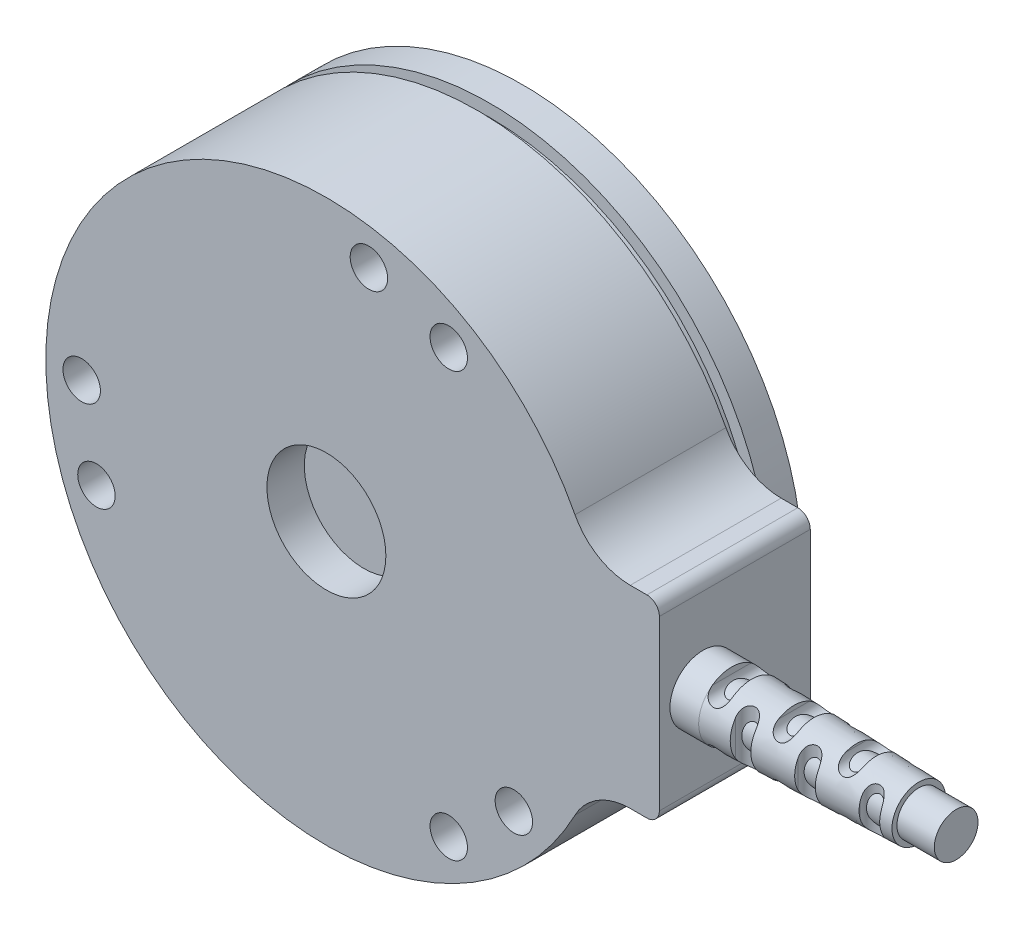
from build123d import *

# Parameters (mm, degrees)
SCHIZZO1_R                        = 1.5
ESTRUSIONE_ESTRUSIONE1_DEPTH      = 5
SCHIZZO2_R                        = 4.769
TAGLIO_ESTRUSIONE1_DEPTH          = 3
ESTRUSIONE_ESTRUSIONE2_START      = 7.1
ESTRUSIONE_ESTRUSIONE2_DEPTH      = 7.1
SCHIZZO4_R                        = 21.5
ESTRUSIONE_ESTRUSIONE3_DEPTH      = 1
ESTRUSIONE_ESTRUSIONE4_START      = 2.6
SCHIZZO5_R                        = 22.5
ESTRUSIONE_ESTRUSIONE4_DEPTH      = 2.6
SCHIZZO6_R                        = 2.65
ESTRUSIONE_ESTRUSIONE5_DEPTH      = 17.3
SMUSSO1_SIZE                      = 15
SMUSSO1_SIZE2                     = 0.5
TAGLIO_ESTRUSIONE2_DEPTH          = 52.853061626
TAGLIO_ESTRUSIONE3_DEPTH          = 55.456886698
ESTRUSIONE_ESTRUSIONE6_DEPTH      = 3
ESTRUSIONE_ESTRUSIONE6_DEPTH_BACK = 17.3
SCHIZZO9_R                        = 1.75
SCHIZZO10_R                       = 1.5
SCHIZZO10_R_2                     = 4.788
TAGLIO_ESTRUSIONE4_DEPTH          = 3


with BuildPart() as part:
    # Schizzo1 → Estrusione-Estrusione1 (new body)
    with BuildSketch(Plane.XY):
        with BuildLine():
            Line((26.7, 6.75), (26.7, -6.75))
            ThreePointArc((26.7, -6.75), (26.407106781, -7.457106781), (25.7, -7.75))
            Line((25.7, -7.75), (24.365703355, -7.75))
            ThreePointArc((24.365703355, -7.75), (21.776389652, -8.472681384), (19.935575473, -10.431818182))
            ThreePointArc((19.935575473, -10.431818182), (-22.5, 0), (19.935575473, 10.431818182))
            ThreePointArc((19.935575473, 10.431818182), (21.776389652, 8.472681384), (24.365703355, 7.75))
            Line((24.365703355, 7.75), (25.7, 7.75))
            ThreePointArc((25.7, 7.75), (26.407106781, 7.457106781), (26.7, 6.75))
        make_face()
        with Locations((9.811, 16.993150473)):
            Circle(SCHIZZO1_R, mode=Mode.SUBTRACT)
        with Locations(Location((3.407324542, 19.32389773, 0), (0, 0, 180))):
            Circle(SCHIZZO1_R, mode=Mode.SUBTRACT)
        with Locations(Location((15.031324063, -12.612778477, 0), (0, 0, 180))):
            Circle(SCHIZZO1_R, mode=Mode.SUBTRACT)
        with Locations((9.811, -16.993150473)):
            Circle(SCHIZZO1_R, mode=Mode.SUBTRACT)
        with Locations(Location((-18.438648605, -6.711119252, 0), (0, 0, 180))):
            Circle(SCHIZZO1_R, mode=Mode.SUBTRACT)
        with Locations((-19.622, 0)):
            Circle(SCHIZZO1_R, mode=Mode.SUBTRACT)
    extrude(amount=ESTRUSIONE_ESTRUSIONE1_DEPTH)

    # Schizzo2 → Taglio-Estrusione1 (cut)
    with BuildSketch(Plane.XY.offset(5)):
        Circle(SCHIZZO2_R)
    extrude(amount=-TAGLIO_ESTRUSIONE1_DEPTH, mode=Mode.SUBTRACT)

    # Schizzo3 → Estrusione-Estrusione2 (add)
    with BuildSketch(Plane(origin=(0, 0, 0), x_dir=(-1, 0, 0), z_dir=(0, 0, -1)).offset(ESTRUSIONE_ESTRUSIONE2_START)):
        with BuildLine():
            Line((-26.7, 6.75), (-26.7, -6.75))
            ThreePointArc((-26.7, -6.75), (-26.407106781, -7.457106781), (-25.7, -7.75))
            Line((-25.7, -7.75), (-24.365703355, -7.75))
            ThreePointArc((-24.365703355, -7.75), (-21.776389652, -8.472681384), (-19.935575473, -10.431818182))
            ThreePointArc((-19.935575473, -10.431818182), (22.5, 0), (-19.935575473, 10.431818182))
            ThreePointArc((-19.935575473, 10.431818182), (-21.776389652, 8.472681384), (-24.365703355, 7.75))
            Line((-24.365703355, 7.75), (-25.7, 7.75))
            ThreePointArc((-25.7, 7.75), (-26.407106781, 7.457106781), (-26.7, 6.75))
        make_face()
    extrude(amount=-ESTRUSIONE_ESTRUSIONE2_DEPTH)

    # Schizzo4 → Estrusione-Estrusione3 (add)
    with BuildSketch(Plane(origin=(0, 0, -7.1), x_dir=(-1, 0, 0), z_dir=(0, 0, -1))):
        Circle(SCHIZZO4_R)
    extrude(amount=ESTRUSIONE_ESTRUSIONE3_DEPTH)

    # Schizzo5 → Estrusione-Estrusione4 (add)
    with BuildSketch(Plane(origin=(0, 0, -8.1), x_dir=(-1, 0, 0), z_dir=(0, 0, -1)).offset(ESTRUSIONE_ESTRUSIONE4_START)):
        Circle(SCHIZZO5_R)
    extrude(amount=-ESTRUSIONE_ESTRUSIONE4_DEPTH)

    # Schizzo6 → Estrusione-Estrusione5 (add)
    with BuildSketch(Plane(origin=(26.7, 0, 0), x_dir=(0, 0, -1), z_dir=(1, 0, 0))):
        with Locations(Location((-1.5, 0, 0), (0, 0, 180))):
            Circle(SCHIZZO6_R)
    extrude(amount=ESTRUSIONE_ESTRUSIONE5_DEPTH)

    # Smusso1
    smusso1_edges = [part.edges().sort_by_distance(p)[0] for p in [
        (44, 0, -1.15),
    ]]
    smusso1_side = [part.faces().sort_by_distance(p)[0] for p in [
        (35.35, 0, -1.15),
    ]]
    chamfer(smusso1_edges, length=SMUSSO1_SIZE, length2=SMUSSO1_SIZE2, reference=smusso1_side[0])

    # Schizzo7 → Taglio-Estrusione2 (cut, through all)
    with BuildSketch(Plane.XY.offset(5)):
        with BuildLine():
            Line((29, 2.15), (29, 3.15))
            ThreePointArc((29, 3.15), (29.8, 3.95), (30.6, 3.15))
            Line((30.6, 3.15), (30.6, 2.15))
            ThreePointArc((30.6, 2.15), (29.8, 1.35), (29, 2.15))
        make_face()
        with BuildLine():
            Line((34, 2.15), (34, 3.15))
            ThreePointArc((34, 3.15), (34.8, 3.95), (35.6, 3.15))
            Line((35.6, 3.15), (35.6, 2.15))
            ThreePointArc((35.6, 2.15), (34.8, 1.35), (34, 2.15))
        make_face()
        with BuildLine():
            Line((39, 2.15), (39, 3.15))
            ThreePointArc((39, 3.15), (39.8, 3.95), (40.6, 3.15))
            Line((40.6, 3.15), (40.6, 2.15))
            ThreePointArc((40.6, 2.15), (39.8, 1.35), (39, 2.15))
        make_face()
        with BuildLine():
            Line((39, -2.15), (39, -3.15))
            ThreePointArc((39, -3.15), (39.8, -3.95), (40.6, -3.15))
            Line((40.6, -3.15), (40.6, -2.15))
            ThreePointArc((40.6, -2.15), (39.8, -1.35), (39, -2.15))
        make_face()
        with BuildLine():
            Line((34, -2.15), (34, -3.15))
            ThreePointArc((34, -3.15), (34.8, -3.95), (35.6, -3.15))
            Line((35.6, -3.15), (35.6, -2.15))
            ThreePointArc((35.6, -2.15), (34.8, -1.35), (34, -2.15))
        make_face()
        with BuildLine():
            Line((29, -2.15), (29, -3.15))
            ThreePointArc((29, -3.15), (29.8, -3.95), (30.6, -3.15))
            Line((30.6, -3.15), (30.6, -2.15))
            ThreePointArc((30.6, -2.15), (29.8, -1.35), (29, -2.15))
        make_face()
    extrude(amount=-TAGLIO_ESTRUSIONE2_DEPTH, mode=Mode.SUBTRACT)

    # Schizzo8 → Taglio-Estrusione3 (cut, through all)
    with BuildSketch(Plane(origin=(0, 7.75, 0), x_dir=(1, 0, 0), z_dir=(0, 1, 0))):
        with BuildLine():
            Line((31.45, 0.65), (31.45, 1.65))
            ThreePointArc((31.45, 1.65), (32.25, 2.45), (33.05, 1.65))
            Line((33.05, 1.65), (33.05, 0.65))
            ThreePointArc((33.05, 0.65), (32.25, -0.15), (31.45, 0.65))
        make_face()
        with BuildLine():
            Line((36.45, 0.65), (36.45, 1.65))
            ThreePointArc((36.45, 1.65), (37.25, 2.45), (38.05, 1.65))
            Line((38.05, 1.65), (38.05, 0.65))
            ThreePointArc((38.05, 0.65), (37.25, -0.15), (36.45, 0.65))
        make_face()
        with BuildLine():
            Line((41.45, 0.65), (41.45, 1.65))
            ThreePointArc((41.45, 1.65), (42.25, 2.45), (43.05, 1.65))
            Line((43.05, 1.65), (43.05, 0.65))
            ThreePointArc((43.05, 0.65), (42.25, -0.15), (41.45, 0.65))
        make_face()
        with BuildLine():
            Line((41.45, -3.65), (41.45, -4.65))
            ThreePointArc((41.45, -4.65), (42.25, -5.45), (43.05, -4.65))
            Line((43.05, -4.65), (43.05, -3.65))
            ThreePointArc((43.05, -3.65), (42.25, -2.85), (41.45, -3.65))
        make_face()
        with BuildLine():
            Line((36.45, -3.65), (36.45, -4.65))
            ThreePointArc((36.45, -4.65), (37.25, -5.45), (38.05, -4.65))
            Line((38.05, -4.65), (38.05, -3.65))
            ThreePointArc((38.05, -3.65), (37.25, -2.85), (36.45, -3.65))
        make_face()
        with BuildLine():
            Line((31.45, -3.65), (31.45, -4.65))
            ThreePointArc((31.45, -4.65), (32.25, -5.45), (33.05, -4.65))
            Line((33.05, -4.65), (33.05, -3.65))
            ThreePointArc((33.05, -3.65), (32.25, -2.85), (31.45, -3.65))
        make_face()
    extrude(amount=-TAGLIO_ESTRUSIONE3_DEPTH, mode=Mode.SUBTRACT)

    # Schizzo9 → Estrusione-Estrusione6 (add, two sides: drawn at the far end of the back side and taken through both)
    with BuildSketch(Plane(origin=(44, 0, 0), x_dir=(0, 0, -1), z_dir=(1, 0, 0)).offset(-ESTRUSIONE_ESTRUSIONE6_DEPTH_BACK)):
        with Locations((-1.5, 0)):
            Circle(SCHIZZO9_R)
    extrude(amount=ESTRUSIONE_ESTRUSIONE6_DEPTH + ESTRUSIONE_ESTRUSIONE6_DEPTH_BACK)

    # Schizzo10 → Taglio-Estrusione4 (cut)
    with BuildSketch(Plane(origin=(0, 0, -10.7), x_dir=(-1, 0, 0), z_dir=(0, 0, -1))):
        with Locations((13.885789317, -2.448439305)):
            Circle(SCHIZZO10_R)
        with Locations((12.210958193, 7.05)):
            Circle(SCHIZZO10_R)
        with Locations((0, -14.1)):
            Circle(SCHIZZO10_R)
        with Locations((-9.063305297, -10.801226648)):
            Circle(SCHIZZO10_R)
        with Locations((-12.210958193, 7.05)):
            Circle(SCHIZZO10_R)
        with Locations((-4.822484021, 13.249665953)):
            Circle(SCHIZZO10_R)
        Circle(SCHIZZO10_R_2)
    extrude(amount=-TAGLIO_ESTRUSIONE4_DEPTH, mode=Mode.SUBTRACT)


solid = part.part
